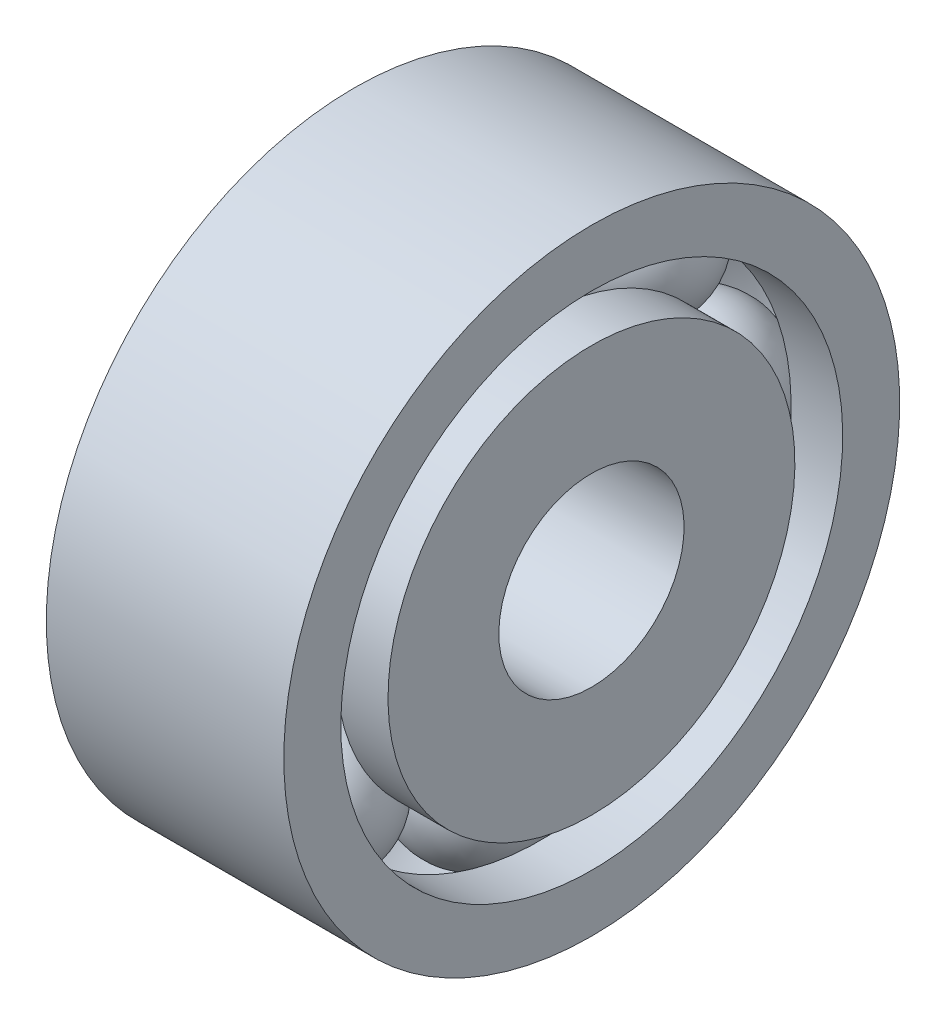
from build123d import *

# Parameters (mm, degrees)
CIRPATTERN2_COUNT = 8


with BuildPart() as part:
    # Sketch1 → Revolve1 (revolve)
    with BuildSketch(Plane.XY):
        with BuildLine():
            Line((-6.333758795, 16.466511751), (-6.333758795, 13.418511751))
            Line((-6.333758795, 13.418511751), (-4.843515161, 13.418511751))
            Line((-4.843515161, 13.418511751), (-3.575861243, 13.418511751))
            ThreePointArc((-3.575861243, 13.418511751), (0.016241205, 15.958511751), (3.608343654, 13.418511751))
            Line((3.608343654, 13.418511751), (4.875997572, 13.418511751))
            Line((4.875997572, 13.418511751), (6.366241205, 13.418511751))
            Line((6.366241205, 13.418511751), (6.366241205, 16.466511751))
            Line((6.366241205, 16.466511751), (-6.333758795, 16.466511751))
        make_face()
    revolve(axis=Axis((-6.333758795, 0, 0), (1, 0, 0)))


with BuildPart() as body_2:
    # Sketch4 → Revolve2 (revolve)
    with BuildSketch(Plane.XY, mode=Mode.PRIVATE) as revolve2_sk:
        with BuildLine():
            Line((-6.35, 10.878511644), (-6.35, 4.953))
            Line((-6.35, 4.953), (6.35, 4.953))
            Line((6.35, 4.953), (6.35, 10.878511644))
            Line((6.35, 10.878511644), (3.592102448, 10.878511644))
            ThreePointArc((3.592102448, 10.878511644), (0, 8.338511644), (-3.592102448, 10.878511644))
            Line((-3.592102448, 10.878511644), (-6.35, 10.878511644))
        make_face()
    revolve(revolve2_sk.sketch.rotate(Axis((6.35, 0, 0), (-1, 0, 0)), 180), axis=Axis((6.35, 0, 0), (-1, 0, 0)))


with BuildPart() as body_3:
    # Sketch5 → Revolve5 (revolve)
    with BuildSketch(Plane.XY):
        with BuildLine():
            Line((0, 8.402011644), (0, 15.895011644))
            ThreePointArc((0, 15.895011644), (3.7465, 12.148511644), (0, 8.402011644))
        make_face()
    revolve(axis=Axis((0, 0, 0), (0, 1, 0)))


with BuildPart() as cirpattern2_1:
    # CirPattern2: pattern copy
    add(body_3.part.rotate(Axis((0, 0, 0), (1, 0, 0)), 1 * 360 / CIRPATTERN2_COUNT))


with BuildPart() as cirpattern2_2:
    # CirPattern2: pattern copy
    add(body_3.part.rotate(Axis((0, 0, 0), (1, 0, 0)), 2 * 360 / CIRPATTERN2_COUNT))


with BuildPart() as cirpattern2_3:
    # CirPattern2: pattern copy
    add(body_3.part.rotate(Axis((0, 0, 0), (1, 0, 0)), 3 * 360 / CIRPATTERN2_COUNT))


with BuildPart() as cirpattern2_4:
    # CirPattern2: pattern copy
    add(body_3.part.rotate(Axis((0, 0, 0), (1, 0, 0)), 4 * 360 / CIRPATTERN2_COUNT))


with BuildPart() as cirpattern2_5:
    # CirPattern2: pattern copy
    add(body_3.part.rotate(Axis((0, 0, 0), (1, 0, 0)), 5 * 360 / CIRPATTERN2_COUNT))


with BuildPart() as cirpattern2_6:
    # CirPattern2: pattern copy
    add(body_3.part.rotate(Axis((0, 0, 0), (1, 0, 0)), 6 * 360 / CIRPATTERN2_COUNT))


with BuildPart() as cirpattern2_7:
    # CirPattern2: pattern copy
    add(body_3.part.rotate(Axis((0, 0, 0), (1, 0, 0)), 7 * 360 / CIRPATTERN2_COUNT))


solid = Compound([part.part, body_2.part, body_3.part, cirpattern2_1.part, cirpattern2_2.part, cirpattern2_3.part, cirpattern2_4.part, cirpattern2_5.part, cirpattern2_6.part, cirpattern2_7.part])
